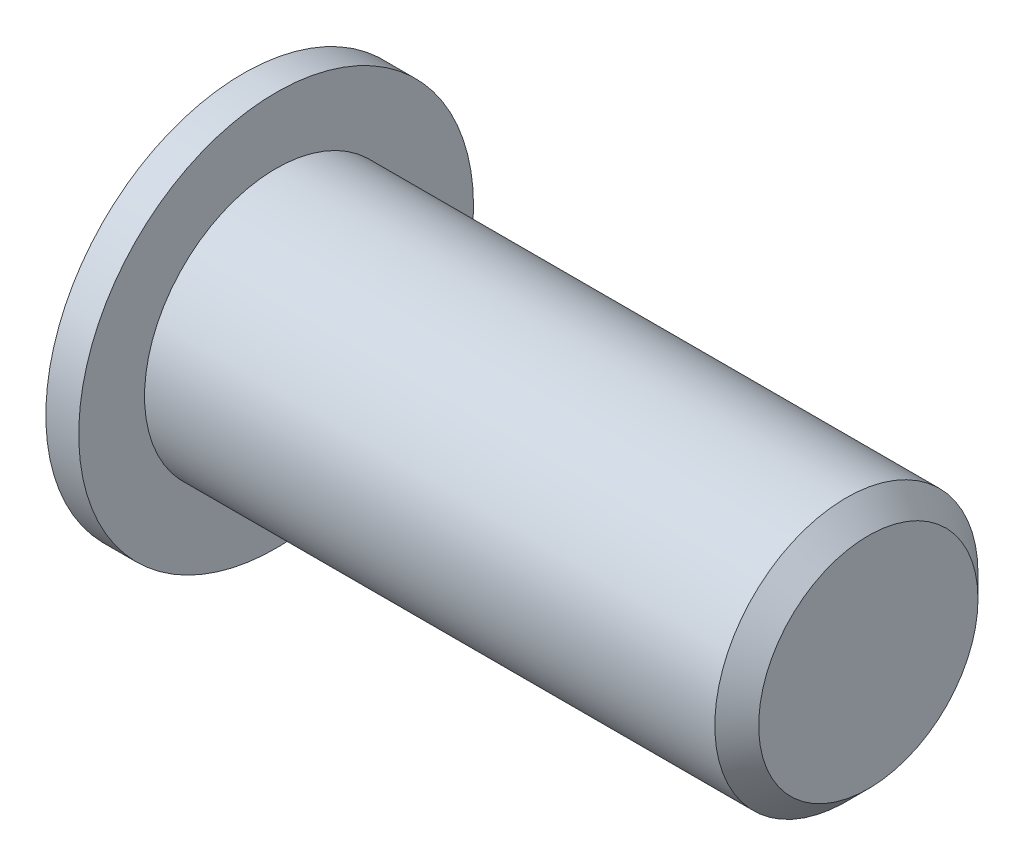
from build123d import *

# Parameters (mm, degrees)
CHAMFER5_SIZE = 0.333333333


with BuildPart() as part:
    # Sketch1 → Revolve1 (revolve)
    with BuildSketch(Plane(origin=(0, 0, 0), x_dir=(1, 0, 0), z_dir=(0, 1, 0))):
        Polygon((0, 0), (0.5, 0), (0.5, -1), (9.5, -1), (9.5, -3), (0, -3), align=None)
    revolve(axis=Axis((9.5, 0, 3), (-1, 0, 0)))

    # Chamfer5
    chamfer5_edges = [part.edges().sort_by_distance(p)[0] for p in [
        (9.5, 0, 5),
    ]]
    chamfer(chamfer5_edges, length=CHAMFER5_SIZE)


solid = part.part
